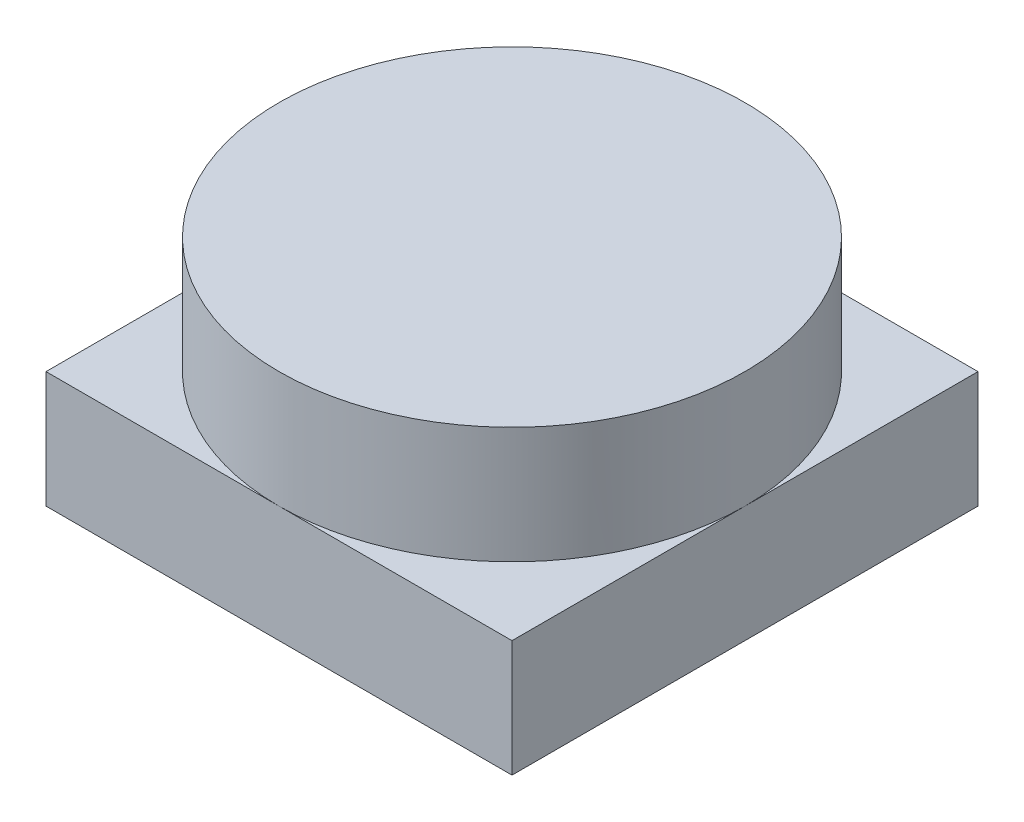
from build123d import *

# Parameters (mm, degrees)
SKETCH1_R           = 10
BOSS_EXTRUDE1_DEPTH = 10
SKETCH2_W           = 20
SKETCH2_H           = 20
BOSS_EXTRUDE2_DEPTH = 5


with BuildPart() as part:
    # Sketch1 → Boss-Extrude1 (new body)
    with BuildSketch(Plane(origin=(0, 0, 0), x_dir=(1, 0, 0), z_dir=(0, 1, 0))):
        with Locations(Location((0, 0, 0), (0, 0, 270))):
            Circle(SKETCH1_R)
    extrude(amount=BOSS_EXTRUDE1_DEPTH)

    # Sketch2 → Boss-Extrude2 (add)
    with BuildSketch(Plane(origin=(0, 0, 0), x_dir=(1, 0, 0), z_dir=(0, 1, 0))):
        Rectangle(SKETCH2_W, SKETCH2_H)
    extrude(amount=BOSS_EXTRUDE2_DEPTH)


solid = part.part
